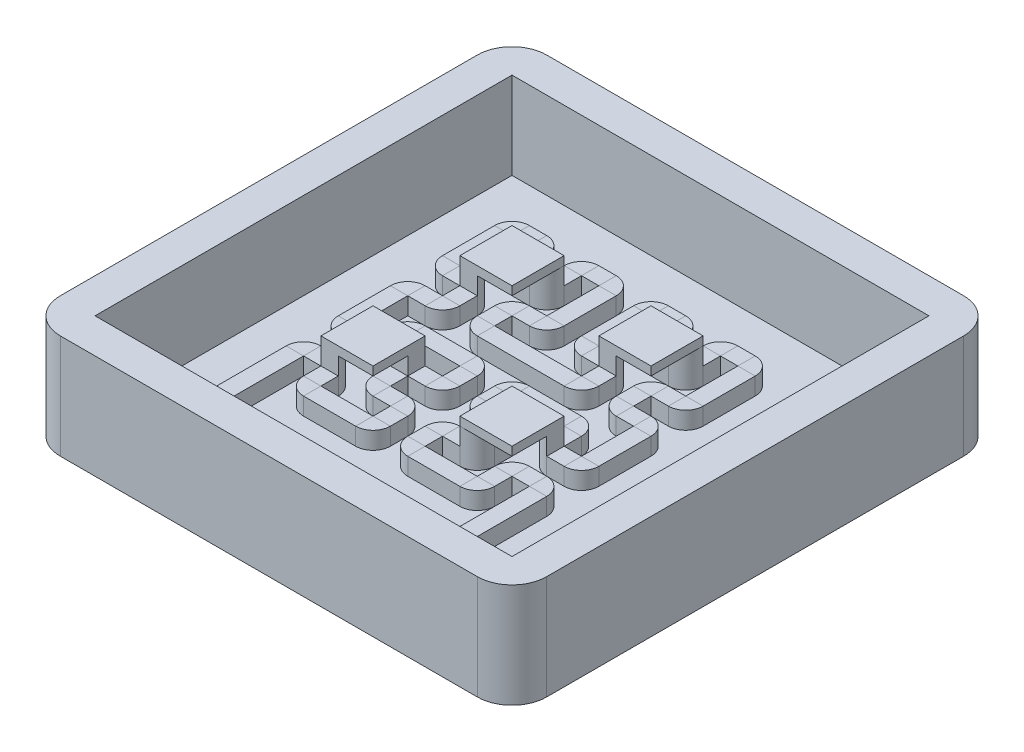
from build123d import *

# Parameters (mm, degrees)
SKETCH3_W            = 1
SKETCH3_H            = 1
SKETCH4_W            = 1
SKETCH4_H            = 1
BOSS_EXTRUDE1_DEPTH  = 5
SKETCH7_W            = 24
SKETCH7_H            = 24
BOSS_EXTRUDE4_DEPTH  = 1
SKETCH8_W            = 28
SKETCH8_H            = 28
SKETCH8_W_2          = 24
SKETCH8_H_2          = 24
BOSS_EXTRUDE5_DEPTH  = 5
FILLET1_R            = 2
BOSS_EXTRUDE11_DEPTH = 1
BOSS_EXTRUDE10_START = 1
SKETCH16_W           = 24
SKETCH16_H           = 24
BOSS_EXTRUDE10_DEPTH = 1
SKETCH18_W           = 3
SKETCH18_H           = 3
BOSS_EXTRUDE12_DEPTH = 0.5


with BuildPart() as part:
    # Sweep1: sweep along a path in Sketch2
    with BuildLine(Plane(origin=(0, 0, 0), x_dir=(1, 0, 0), z_dir=(0, 1, 0))) as sweep1_path:
        Line((0, 0), (0, 1.5))
        ThreePointArc((0, 1.5), (0.146446609, 1.853553391), (0.5, 2))
        Line((0.5, 2), (1.5, 2))
        ThreePointArc((1.5, 2), (1.853553391, 1.853553391), (2, 1.5))
        Line((2, 1.5), (2, 0.5))
        ThreePointArc((2, 0.5), (2.146446609, 0.146446609), (2.5, 0))
        Line((2.5, 0), (5.5, 0))
        ThreePointArc((5.5, 0), (5.853553391, 0.146446609), (6, 0.5))
        Line((6, 0.5), (6, 1.5))
        ThreePointArc((6, 1.5), (5.853553391, 1.853553391), (5.5, 2))
        Line((5.5, 2), (4.5, 2))
        ThreePointArc((4.5, 2), (4.146446609, 2.146446609), (4, 2.5))
        Line((4, 2.5), (4, 3.5))
        ThreePointArc((4, 3.5), (4.146446609, 3.853553391), (4.5, 4))
        Line((4.5, 4), (5.5, 4))
        ThreePointArc((5.5, 4), (5.853553391, 4.146446609), (6, 4.5))
        Line((6, 4.5), (6, 5.5))
        ThreePointArc((6, 5.5), (5.853553391, 5.853553391), (5.5, 6))
        Line((5.5, 6), (2.5, 6))
        ThreePointArc((2.5, 6), (2.146446609, 5.853553391), (2, 5.5))
        Line((2, 5.5), (2, 4.5))
        ThreePointArc((2, 4.5), (1.853553391, 4.146446609), (1.5, 4))
        Line((1.5, 4), (0.5, 4))
        ThreePointArc((0.5, 4), (0.146446609, 4.146446609), (0, 4.5))
        Line((0, 4.5), (0, 7.5))
        ThreePointArc((0, 7.5), (0.146446609, 7.853553391), (0.5, 8))
        Line((0.5, 8), (1.5, 8))
        ThreePointArc((1.5, 8), (1.853553391, 8.146446609), (2, 8.5))
        Line((2, 8.5), (2, 9.5))
        ThreePointArc((2, 9.5), (1.853553391, 9.853553391), (1.5, 10))
        Line((1.5, 10), (0.5, 10))
        ThreePointArc((0.5, 10), (0.146446609, 10.146446609), (0, 10.5))
        Line((0, 10.5), (0, 13.5))
        ThreePointArc((0, 13.5), (0.146446609, 13.853553391), (0.5, 14))
        Line((0.5, 14), (1.5, 14))
        ThreePointArc((1.5, 14), (1.853553391, 13.853553391), (2, 13.5))
        Line((2, 13.5), (2, 12.5))
        ThreePointArc((2, 12.5), (2.146446609, 12.146446609), (2.5, 12))
        Line((2.5, 12), (3.5, 12))
        ThreePointArc((3.5, 12), (3.853553391, 12.146446609), (4, 12.5))
        Line((4, 12.5), (4, 13.5))
        ThreePointArc((4, 13.5), (4.146446609, 13.853553391), (4.5, 14))
        Line((4.5, 14), (5.5, 14))
        ThreePointArc((5.5, 14), (5.853553391, 13.853553391), (6, 13.5))
        Line((6, 13.5), (6, 10.5))
        ThreePointArc((6, 10.5), (5.853553391, 10.146446609), (5.5, 10))
        Line((5.5, 10), (4.5, 10))
        ThreePointArc((4.5, 10), (4.146446609, 9.853553391), (4, 9.5))
        Line((4, 9.5), (4, 8.5))
        ThreePointArc((4, 8.5), (4.146446609, 8.146446609), (4.5, 8))
        Line((4.5, 8), (9.5, 8))
        ThreePointArc((9.5, 8), (9.853553391, 8.146446609), (10, 8.5))
        Line((10, 8.5), (10, 9.5))
        ThreePointArc((10, 9.5), (9.853553391, 9.853553391), (9.5, 10))
        Line((9.5, 10), (8.5, 10))
        ThreePointArc((8.5, 10), (8.146446609, 10.146446609), (8, 10.5))
        Line((8, 10.5), (8, 13.5))
        ThreePointArc((8, 13.5), (8.146446609, 13.853553391), (8.5, 14))
        Line((8.5, 14), (9.5, 14))
        ThreePointArc((9.5, 14), (9.853553391, 13.853553391), (10, 13.5))
        Line((10, 13.5), (10, 12.5))
        ThreePointArc((10, 12.5), (10.146446609, 12.146446609), (10.5, 12))
        Line((10.5, 12), (11.5, 12))
        ThreePointArc((11.5, 12), (11.853553391, 12.146446609), (12, 12.5))
        Line((12, 12.5), (12, 13.5))
        ThreePointArc((12, 13.5), (12.146446609, 13.853553391), (12.5, 14))
        Line((12.5, 14), (13.5, 14))
        ThreePointArc((13.5, 14), (13.853553391, 13.853553391), (14, 13.5))
        Line((14, 13.5), (14, 10.5))
        ThreePointArc((14, 10.5), (13.853553391, 10.146446609), (13.5, 10))
        Line((13.5, 10), (12.5, 10))
        ThreePointArc((12.5, 10), (12.146446609, 9.853553391), (12, 9.5))
        Line((12, 9.5), (12, 8.5))
        ThreePointArc((12, 8.5), (12.146446609, 8.146446609), (12.5, 8))
        Line((12.5, 8), (13.5, 8))
        ThreePointArc((13.5, 8), (13.853553391, 7.853553391), (14, 7.5))
        Line((14, 7.5), (14, 4.5))
        ThreePointArc((14, 4.5), (13.853553391, 4.146446609), (13.5, 4))
        Line((13.5, 4), (12.5, 4))
        ThreePointArc((12.5, 4), (12.146446609, 4.146446609), (12, 4.5))
        Line((12, 4.5), (12, 5.5))
        ThreePointArc((12, 5.5), (11.853553391, 5.853553391), (11.5, 6))
        Line((11.5, 6), (8.5, 6))
        ThreePointArc((8.5, 6), (8.146446609, 5.853553391), (8, 5.5))
        Line((8, 5.5), (8, 4.5))
        ThreePointArc((8, 4.5), (8.146446609, 4.146446609), (8.5, 4))
        Line((8.5, 4), (9.5, 4))
        ThreePointArc((9.5, 4), (9.853553391, 3.853553391), (10, 3.5))
        Line((10, 3.5), (10, 2.5))
        ThreePointArc((10, 2.5), (9.853553391, 2.146446609), (9.5, 2))
        Line((9.5, 2), (8.5, 2))
        ThreePointArc((8.5, 2), (8.146446609, 1.853553391), (8, 1.5))
        Line((8, 1.5), (8, 0.5))
        ThreePointArc((8, 0.5), (8.146446609, 0.146446609), (8.5, 0))
        Line((8.5, 0), (11.5, 0))
        ThreePointArc((11.5, 0), (11.853553391, 0.146446609), (12, 0.5))
        Line((12, 0.5), (12, 1.5))
        ThreePointArc((12, 1.5), (12.146446609, 1.853553391), (12.5, 2))
        Line((12.5, 2), (13.5, 2))
        ThreePointArc((13.5, 2), (13.853553391, 1.853553391), (14, 1.5))
        Line((14, 1.5), (14, 0))
    # Sketch3 → Sweep1 (sweep)
    with BuildSketch(Plane.XY):
        Rectangle(SKETCH3_W, SKETCH3_H)
    sweep(path=sweep1_path.line)

    # Sketch4 → Boss-Extrude1 (add)
    with BuildSketch(Plane.XY):
        Rectangle(SKETCH4_W, SKETCH4_H)
        with Locations((14, 0)):
            Rectangle(SKETCH4_W, SKETCH4_H)
    extrude(amount=BOSS_EXTRUDE1_DEPTH)



with BuildPart() as body_2:
    # Sketch7 → Boss-Extrude4 (new body)
    with BuildSketch(Plane(origin=(0, -2, 0), x_dir=(1, 0, 0), z_dir=(0, 1, 0))):
        with Locations((7, 7)):
            Rectangle(SKETCH7_W, SKETCH7_H)
    extrude(amount=-BOSS_EXTRUDE4_DEPTH)


with BuildPart() as part_1:
    add(part.part)

    add(body_2.part)  # Boss-Extrude5 merges body 2
    # Sketch8 → Boss-Extrude5 (add)
    with BuildSketch(Plane.XZ.offset(3)):
        with Locations((7, -7)):
            Rectangle(SKETCH8_W, SKETCH8_H)
        with Locations((7, -7)):
            Rectangle(SKETCH8_W_2, SKETCH8_H_2, mode=Mode.SUBTRACT)
    extrude(amount=-BOSS_EXTRUDE5_DEPTH)

    # Fillet1
    fillet1_edges = [part_1.edges().sort_by_distance(p)[0] for p in [
        (-7, -0.5, -21),
        (-7, -0.5, 7),
        (21, -0.5, 7),
        (21, -0.5, -21),
    ]]
    fillet(fillet1_edges, radius=FILLET1_R)

    # Sketch17 → Boss-Extrude11 (add)
    with BuildSketch(Plane(origin=(0, 0.5, 0), x_dir=(1, 0, 0), z_dir=(0, 1, 0))):
        with BuildLine():
            Line((1.5, 9.5), (1.5, 10.5))
            ThreePointArc((1.5, 10.5), (2.207106781, 10.207106781), (2.5, 9.5))
            Line((2.5, 9.5), (1.5, 9.5))
        make_face()
        with BuildLine():
            Line((3.5, 12.5), (4.5, 12.5))
            ThreePointArc((4.5, 12.5), (4.207106781, 11.792893219), (3.5, 11.5))
            Line((3.5, 11.5), (3.5, 12.5))
        make_face()
        with BuildLine():
            Line((1.5, 1.5), (1.5, 2.5))
            ThreePointArc((1.5, 2.5), (2.207106781, 2.207106781), (2.5, 1.5))
            Line((2.5, 1.5), (1.5, 1.5))
        make_face()
        with BuildLine():
            Line((3.5, 3.5), (4.5, 3.5))
            Line((4.5, 3.5), (4.5, 4.5))
            ThreePointArc((4.5, 4.5), (3.792893219, 4.207106781), (3.5, 3.5))
        make_face()
        with BuildLine():
            Line((9.5, 10.5), (9.5, 9.5))
            Line((9.5, 9.5), (10.5, 9.5))
            ThreePointArc((10.5, 9.5), (10.207106781, 10.207106781), (9.5, 10.5))
        make_face()
        with BuildLine():
            Line((11.5, 11.5), (11.5, 12.5))
            Line((11.5, 12.5), (12.5, 12.5))
            ThreePointArc((12.5, 12.5), (12.207106781, 11.792893219), (11.5, 11.5))
        make_face()
        with BuildLine():
            Line((11.5, 4.5), (12.5, 4.5))
            Line((12.5, 4.5), (12.5, 3.5))
            ThreePointArc((12.5, 3.5), (11.792893219, 3.792893219), (11.5, 4.5))
        make_face()
        with BuildLine():
            Line((10.5, 2.5), (9.5, 2.5))
            Line((9.5, 2.5), (9.5, 1.5))
            ThreePointArc((9.5, 1.5), (10.207106781, 1.792893219), (10.5, 2.5))
        make_face()
    extrude(amount=BOSS_EXTRUDE11_DEPTH)

    # Sketch16 → Boss-Extrude10 (add)
    with BuildSketch(Plane(origin=(0, 2, 0), x_dir=(1, 0, 0), z_dir=(0, 1, 0)).offset(BOSS_EXTRUDE10_START)):
        with BuildLine():
            Line((-7, 19), (-7, -5))
            ThreePointArc((-7, -5), (-6.414213562, -6.414213562), (-5, -7))
            Line((-5, -7), (19, -7))
            ThreePointArc((19, -7), (20.414213562, -6.414213562), (21, -5))
            Line((21, -5), (21, 19))
            ThreePointArc((21, 19), (20.414213562, 20.414213562), (19, 21))
            Line((19, 21), (-5, 21))
            ThreePointArc((-5, 21), (-6.414213562, 20.414213562), (-7, 19))
        make_face()
        with Locations((7, 7)):
            Rectangle(SKETCH16_W, SKETCH16_H, mode=Mode.SUBTRACT)
    extrude(amount=-BOSS_EXTRUDE10_DEPTH)

    # Sketch18 → Boss-Extrude12 (add)
    with BuildSketch(Plane(origin=(0, 1.5, 0), x_dir=(1, 0, 0), z_dir=(0, 1, 0))):
        with Locations((11, 11)):
            Rectangle(SKETCH18_W, SKETCH18_H)
        with Locations((3, 11)):
            Rectangle(SKETCH18_W, SKETCH18_H)
        with Locations((3, 3)):
            Rectangle(SKETCH18_W, SKETCH18_H)
        with Locations((11, 3)):
            Rectangle(SKETCH18_W, SKETCH18_H)
    extrude(amount=BOSS_EXTRUDE12_DEPTH)


solid = part_1.part
